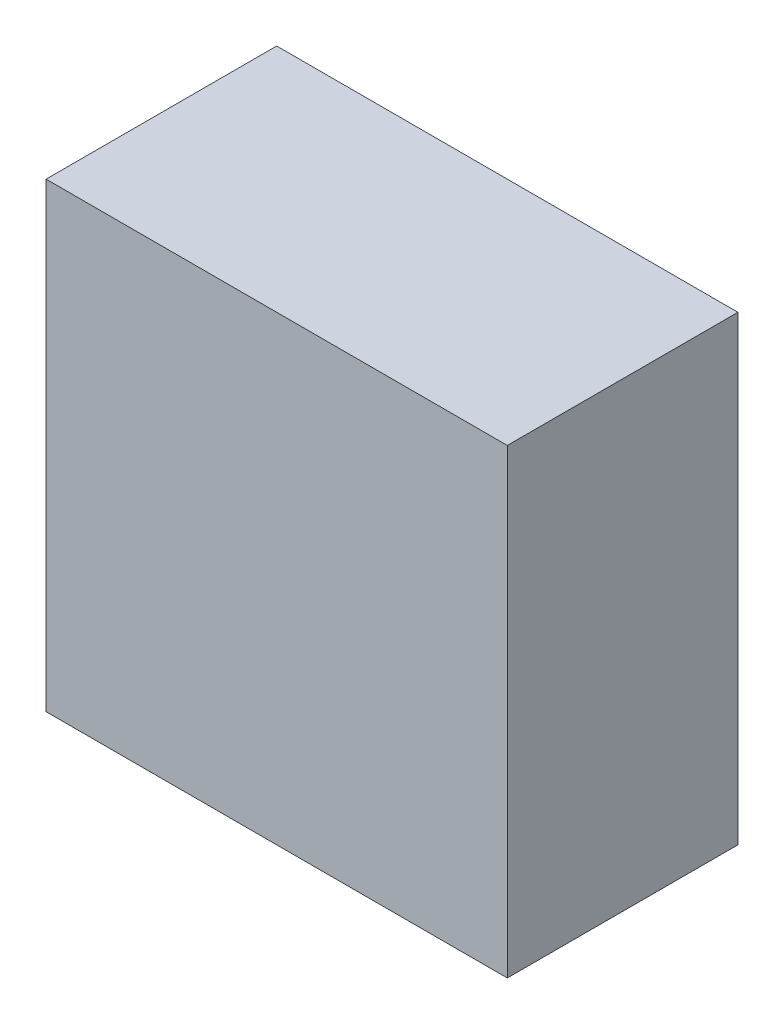
from build123d import *

# Parameters (mm, degrees)
SKETCH1_W           = 20
SKETCH1_H           = 20
BOSS_EXTRUDE1_DEPTH = 10


with BuildPart() as part:
    # Sketch1 → Boss-Extrude1 (new body)
    with BuildSketch(Plane.XY):
        with Locations((-25.358848172, -34.952530347)):
            Rectangle(SKETCH1_W, SKETCH1_H)
    extrude(amount=BOSS_EXTRUDE1_DEPTH)


solid = part.part
